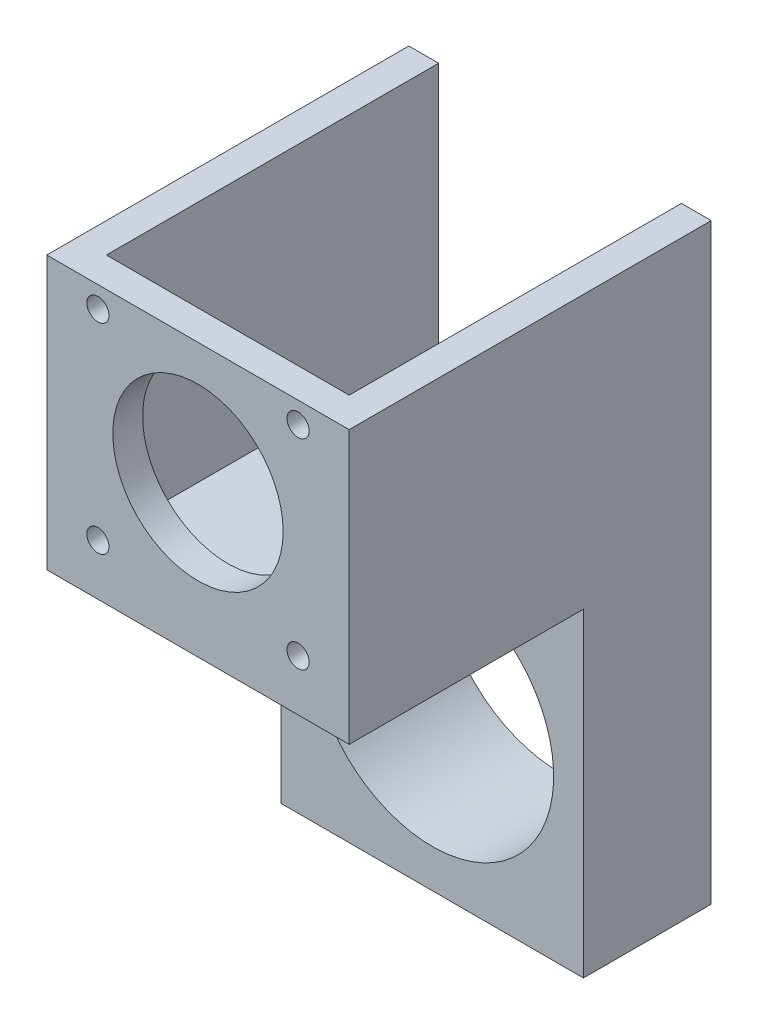
from build123d import *

# Parameters (mm, degrees)
SKETCH1_R                = 2.6
BOSS_EXTRUDE1_DEPTH      = 7
SKETCH3_R                = 20
CUT_EXTRUDE1_DEPTH       = 105.322688225
BOSS_EXTRUDE2_DEPTH      = 75
BOSS_EXTRUDE3_DEPTH      = 10
BOSS_EXTRUDE3_DEPTH_BACK = 20
SKETCH5_R                = 28.5


with BuildPart() as part:
    # Sketch1 → Boss-Extrude1 (new body)
    with BuildSketch(Plane.XY):
        Polygon((-81.297129584, 62), (-81.297129584, 25.5), (-81.297129584, 8), (-78.297129584, 8), (-41.797129584, 8), (-24.297129584, 8), (-24.297129584, 11), (-24.297129584, 47.5), (-24.297129584, 65), (-27.297129584, 65), (-63.797129584, 65), (-81.297129584, 65), align=None)
        with Locations((-76.297129584, 13)):
            Circle(SKETCH1_R, mode=Mode.SUBTRACT)
        with Locations((-29.297129584, 13)):
            Circle(SKETCH1_R, mode=Mode.SUBTRACT)
        with Locations((-29.297129584, 60)):
            Circle(SKETCH1_R, mode=Mode.SUBTRACT)
        with Locations((-76.297129584, 60)):
            Circle(SKETCH1_R, mode=Mode.SUBTRACT)
    extrude(amount=BOSS_EXTRUDE1_DEPTH)

    # Sketch3 → Cut-Extrude1 (cut, through all)
    with BuildSketch(Plane.XY.offset(7)):
        with Locations((-52.797129584, 36.5)):
            Circle(SKETCH3_R)
    extrude(amount=-CUT_EXTRUDE1_DEPTH, mode=Mode.SUBTRACT)

    # Sketch4 → Boss-Extrude2 (add)
    with BuildSketch(Plane.XY.offset(7)):
        Polygon((-24.297129584, 65), (-17.297129584, 65), (-17.297129584, 1), (-88.297129584, 1), (-88.297129584, 65), (-81.297129584, 65), (-81.297129584, 8), (-24.297129584, 8), align=None)
    extrude(amount=-BOSS_EXTRUDE2_DEPTH)

    # Sketch5 → Boss-Extrude3 (add, two sides: drawn at the far end of the back side and taken through both)
    with BuildSketch(Plane(origin=(0, 0, -68), x_dir=(-1, 0, 0), z_dir=(0, 0, -1)).offset(-BOSS_EXTRUDE3_DEPTH_BACK)):
        Polygon((88.297129584, 1), (88.297129584, -74), (52.797129584, -74), (17.297129584, -74), (17.297129584, 1), (17.297129584, 65), (24.297129584, 65), (24.297129584, 8), (81.297129584, 8), (81.297129584, 65), (88.297129584, 65), align=None)
        with Locations((52.797129584, -36.5)):
            Circle(SKETCH5_R, mode=Mode.SUBTRACT)
    extrude(amount=BOSS_EXTRUDE3_DEPTH + BOSS_EXTRUDE3_DEPTH_BACK)


solid = part.part
